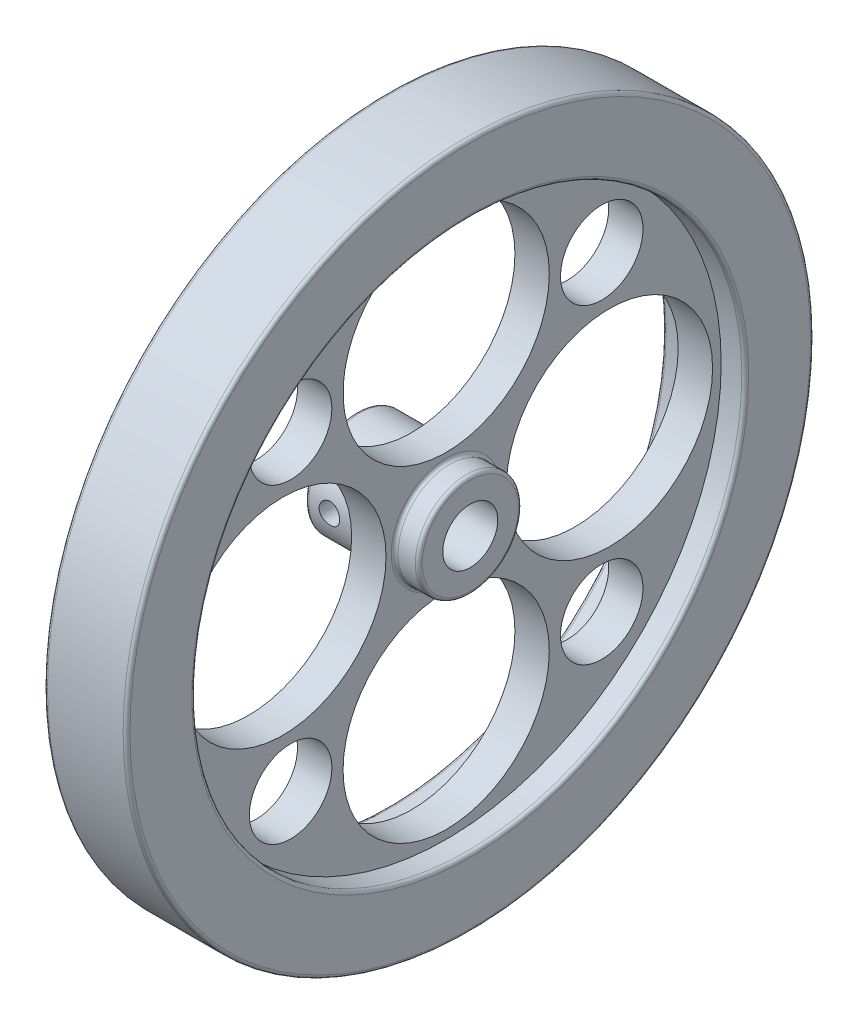
from build123d import *

# Parameters (mm, degrees)
SKETCH1_R           = 7.5
SKETCH1_R_2         = 4
BOSS_EXTRUDE1_DEPTH = 16.5
BOSS_EXTRUDE2_START = -8.5
SKETCH2_R           = 40
SKETCH2_R_2         = 7.5
BOSS_EXTRUDE2_DEPTH = 5
BOSS_EXTRUDE3_START = -12
SKETCH3_R           = 50
SKETCH3_R_2         = 40
BOSS_EXTRUDE3_DEPTH = 12
CUT_EXTRUDE1_REACH  = 73.896
SKETCH4_R           = 15
SKETCH4_R_2         = 6
CIRPATTERN1_COUNT   = 4
SKETCH5_R           = 1.5
CUT_EXTRUDE2_DEPTH  = 21
FILLET1_R           = 0.5


with BuildPart() as part:
    # Sketch1 → Boss-Extrude1 (new body)
    with BuildSketch(Plane(origin=(0, 0, 0), x_dir=(0, 0, -1), z_dir=(1, 0, 0))):
        Circle(SKETCH1_R)
        Circle(SKETCH1_R_2, mode=Mode.SUBTRACT)
    extrude(amount=BOSS_EXTRUDE1_DEPTH)

    # Sketch2 → Boss-Extrude2 (add)
    with BuildSketch(Plane(origin=(16.5, 0, 0), x_dir=(0, 0, -1), z_dir=(1, 0, 0)).offset(BOSS_EXTRUDE2_START)):
        Circle(SKETCH2_R)
        Circle(SKETCH2_R_2, mode=Mode.SUBTRACT)
    extrude(amount=BOSS_EXTRUDE2_DEPTH)

    # Sketch3 → Boss-Extrude3 (add)
    with BuildSketch(Plane(origin=(16.5, 0, 0), x_dir=(0, 0, -1), z_dir=(1, 0, 0)).offset(BOSS_EXTRUDE3_START)):
        Circle(SKETCH3_R)
        Circle(SKETCH3_R_2, mode=Mode.SUBTRACT)
    extrude(amount=BOSS_EXTRUDE3_DEPTH)

    # Sketch4 → Cut-Extrude1 (cut, up to next)
    with BuildSketch(Plane(origin=(13, 0, 0), x_dir=(0, 0, -1), z_dir=(1, 0, 0)), mode=Mode.PRIVATE) as cut_extrude1_sk1:
        with Locations((0, 23.75)):
            Circle(SKETCH4_R)
    cut_extrude1_tool1 = extrude(cut_extrude1_sk1.sketch, amount=-CUT_EXTRUDE1_REACH, mode=Mode.PRIVATE) & part.part
    # Sketch4 → Cut-Extrude1 (cut, up to next)
    with BuildSketch(Plane(origin=(13, 0, 0), x_dir=(0, 0, -1), z_dir=(1, 0, 0)), mode=Mode.PRIVATE) as cut_extrude1_sk2:
        with Locations((-22.627416998, 22.627416998)):
            Circle(SKETCH4_R_2)
    cut_extrude1_tool2 = extrude(cut_extrude1_sk2.sketch, amount=-CUT_EXTRUDE1_REACH, mode=Mode.PRIVATE) & part.part
    cut_extrude1_1 = cut_extrude1_tool1.solids().sort_by_distance((13, 23.75, 0))[0]
    add(cut_extrude1_1, mode=Mode.SUBTRACT)
    cut_extrude1_2 = cut_extrude1_tool2.solids().sort_by_distance((13, 22.627417, 22.627417))[0]
    add(cut_extrude1_2, mode=Mode.SUBTRACT)
    cut_extrude1 = cut_extrude1_1 + cut_extrude1_2  # Cut-Extrude1 as one shape, for the pattern or mirror that repeats it

    # CirPattern1: Cut-Extrude1 ×4 about axis
    cirpattern1_axis = Axis((0, 0, 0), (1, 0, 0))
    for i in range(1, CIRPATTERN1_COUNT):
        add(cut_extrude1.rotate(cirpattern1_axis, i * 360 / CIRPATTERN1_COUNT), mode=Mode.SUBTRACT)

    # Sketch5 → Cut-Extrude2 (cut, symmetric)
    with BuildSketch(Plane.XY):
        with Locations((3.5, 0)):
            Circle(SKETCH5_R)
    extrude(amount=CUT_EXTRUDE2_DEPTH, both=True, mode=Mode.SUBTRACT)

    # Fillet1
    fillet1_edges = [part.edges().sort_by_distance(p)[0] for p in [
        (8, 0, 7.5),
        (13, 0, 7.5),
        (4.5, 0, 50),
        (4.5, 0, 40),
        (16.5, 0, 50),
        (16.5, 0, 40),
        (0, 0, 7.5),
        (16.5, 0, 7.5),
    ]]
    fillet(fillet1_edges, radius=FILLET1_R)


solid = part.part
